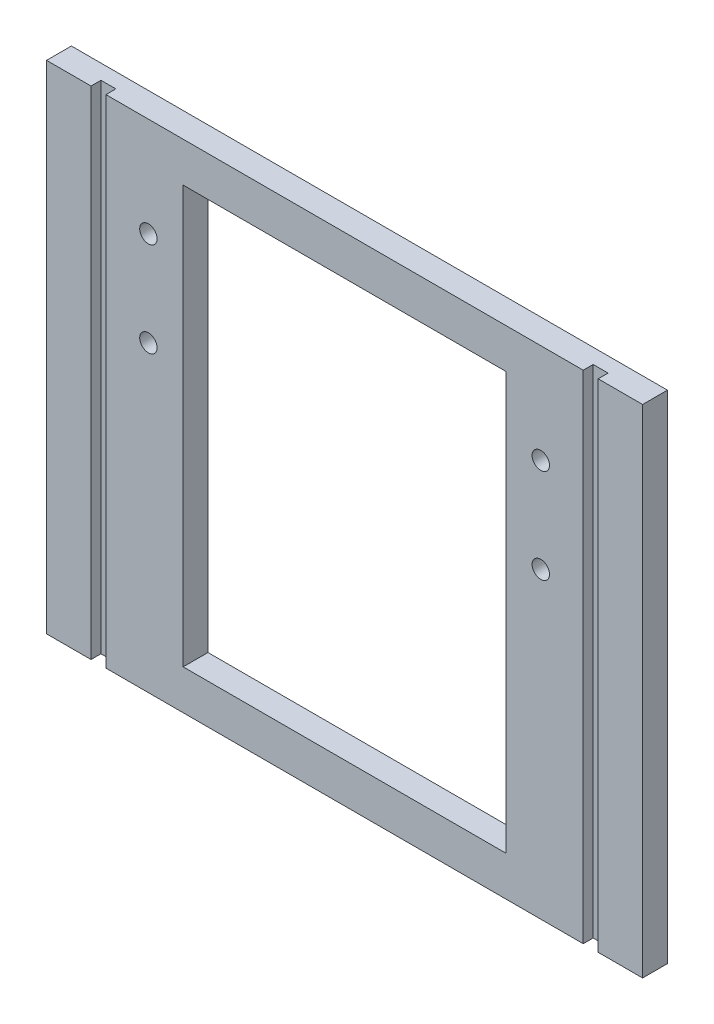
from build123d import *

# Parameters (mm, degrees)
SKETCH_1_W          = 120
SKETCH_1_H          = 100
SKETCH_1_R          = 1.75
SKETCH_1_W_2        = 65
SKETCH_1_H_2        = 84
EXTRUDE_1_DEPTH     = 5
SKETCH_2_W          = 3
SKETCH_2_H          = 100
CUT_EXTRUDE_1_DEPTH = 2


with BuildPart() as part:
    # 草图1 → 凸台-拉伸1 (new body)
    with BuildSketch(Plane.XY):
        with Locations((60, 50)):
            Rectangle(SKETCH_1_W, SKETCH_1_H)
        with Locations((20.5, 80)):
            Circle(SKETCH_1_R, mode=Mode.SUBTRACT)
        with Locations((20.5, 61)):
            Circle(SKETCH_1_R, mode=Mode.SUBTRACT)
        with Locations((99.5, 80)):
            Circle(SKETCH_1_R, mode=Mode.SUBTRACT)
        with Locations((99.5, 61)):
            Circle(SKETCH_1_R, mode=Mode.SUBTRACT)
        with Locations((60, 50)):
            Rectangle(SKETCH_1_W_2, SKETCH_1_H_2, mode=Mode.SUBTRACT)
    extrude(amount=EXTRUDE_1_DEPTH)

    # 草图2 → 切除-拉伸1 (cut)
    with BuildSketch(Plane.XY.offset(5)):
        with Locations((10.45, 50)):
            Rectangle(SKETCH_2_W, SKETCH_2_H)
        with Locations((109.55, 50)):
            Rectangle(SKETCH_2_W, SKETCH_2_H)
    extrude(amount=-CUT_EXTRUDE_1_DEPTH, mode=Mode.SUBTRACT)


solid = part.part
